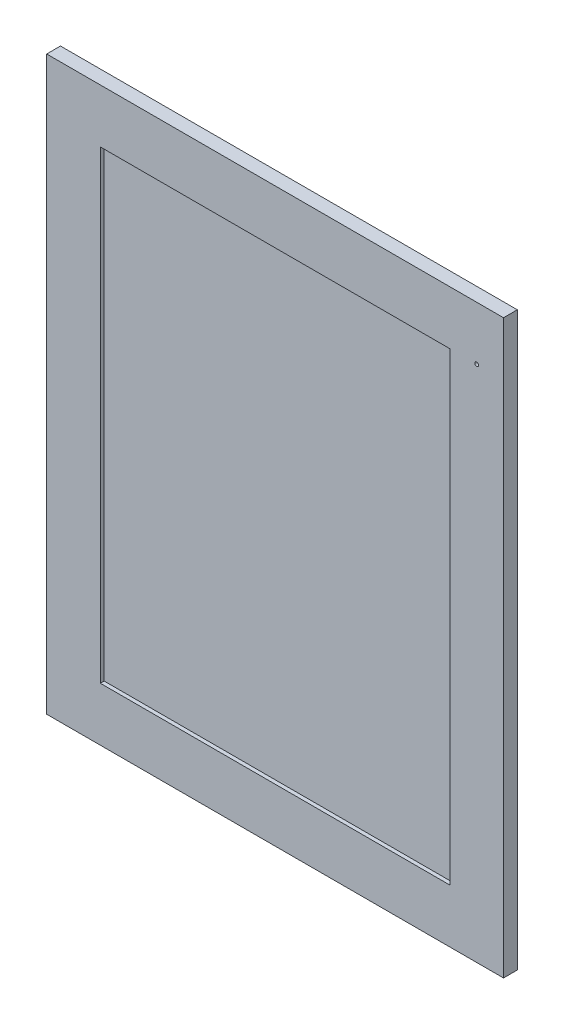
from build123d import *

# Parameters (mm, degrees)
SKETCH1_W          = 596
SKETCH1_H          = 746
DOOR_PART_DEPTH    = 18
SKETCH6_R          = 2.5
BASE_SINGLE_DEPTH  = 956.016230229
SKETCH7_W          = 456
SKETCH7_H          = 606
CUT_EXTRUDE1_DEPTH = 5


with BuildPart() as part:
    # Sketch1 → Door Part (new body)
    with BuildSketch(Plane.XY):
        with Locations((-298, -373)):
            Rectangle(SKETCH1_W, SKETCH1_H)
    extrude(amount=-DOOR_PART_DEPTH)

    # Sketch6 → Base Single (cut, through all)
    with BuildSketch(Plane.XY):
        with Locations((-35, -70)):
            Circle(SKETCH6_R)
    extrude(amount=-BASE_SINGLE_DEPTH, mode=Mode.SUBTRACT)

    # Sketch7 → Cut-Extrude1 (cut)
    with BuildSketch(Plane.XY):
        with Locations((-298, -373)):
            Rectangle(SKETCH7_W, SKETCH7_H)
    extrude(amount=-CUT_EXTRUDE1_DEPTH, mode=Mode.SUBTRACT)


solid = part.part
